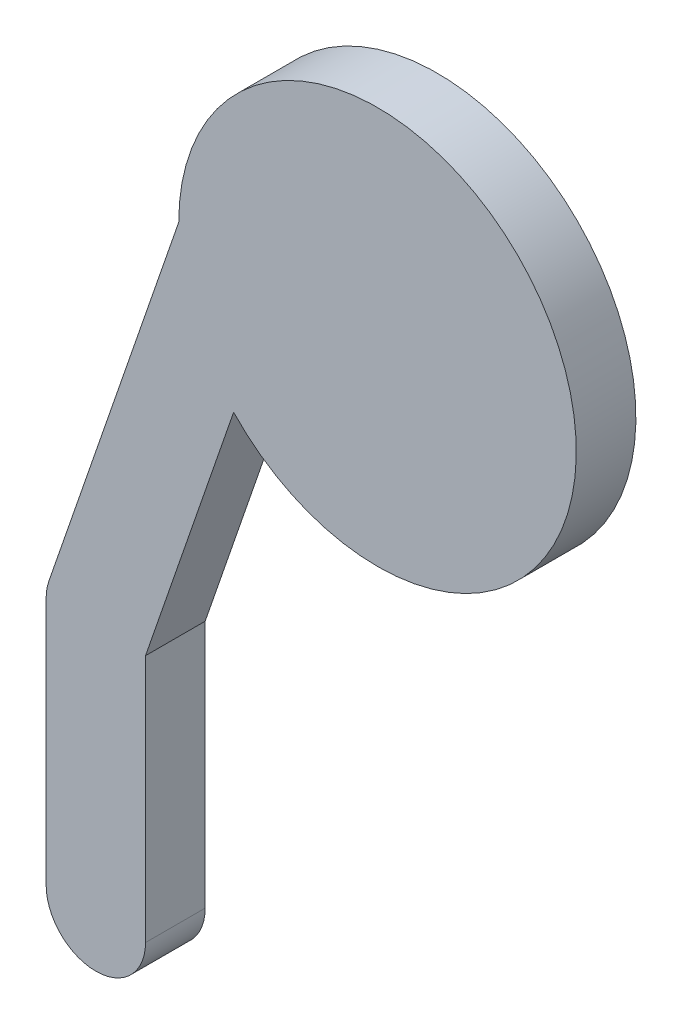
from build123d import *

# Parameters (mm, degrees)
BOSS_EXTRUDE1_DEPTH = 6
SKETCH2_R           = 2.804848486
CUT_EXTRUDE1_DEPTH  = 3


with BuildPart() as part:
    # Sketch1 → Boss-Extrude1 (new body)
    with BuildSketch(Plane(origin=(0, 0, 0), x_dir=(0, 1, 0), z_dir=(0, 0, 1))):
        with BuildLine():
            Line((0, 5), (25, 5))
            ThreePointArc((25, 5), (25.828163089, 4.930937629), (26.633448216, 4.725658359))
            Line((26.633448216, 4.725658359), (64.438715088, -8.341927368))
            ThreePointArc((64.438715088, -8.341927368), (71.86918023, -46.91040032), (50.641475986, -13.863108592))
            Line((50.641475986, -13.863108592), (25, -5))
            Line((25, -5), (0, -5))
            ThreePointArc((0, -5), (-5, 0), (0, 5))
        make_face()
    extrude(amount=BOSS_EXTRUDE1_DEPTH)

    # Sketch2 → Cut-Extrude1 (cut)
    with BuildSketch(Plane(origin=(0, 0, 0), x_dir=(1, 0, 0), z_dir=(0, 0, -1))):
        with Locations(Location((0, 0, 0), (0, 0, 180))):
            Circle(SKETCH2_R)
    extrude(amount=-CUT_EXTRUDE1_DEPTH, mode=Mode.SUBTRACT)


solid = part.part
